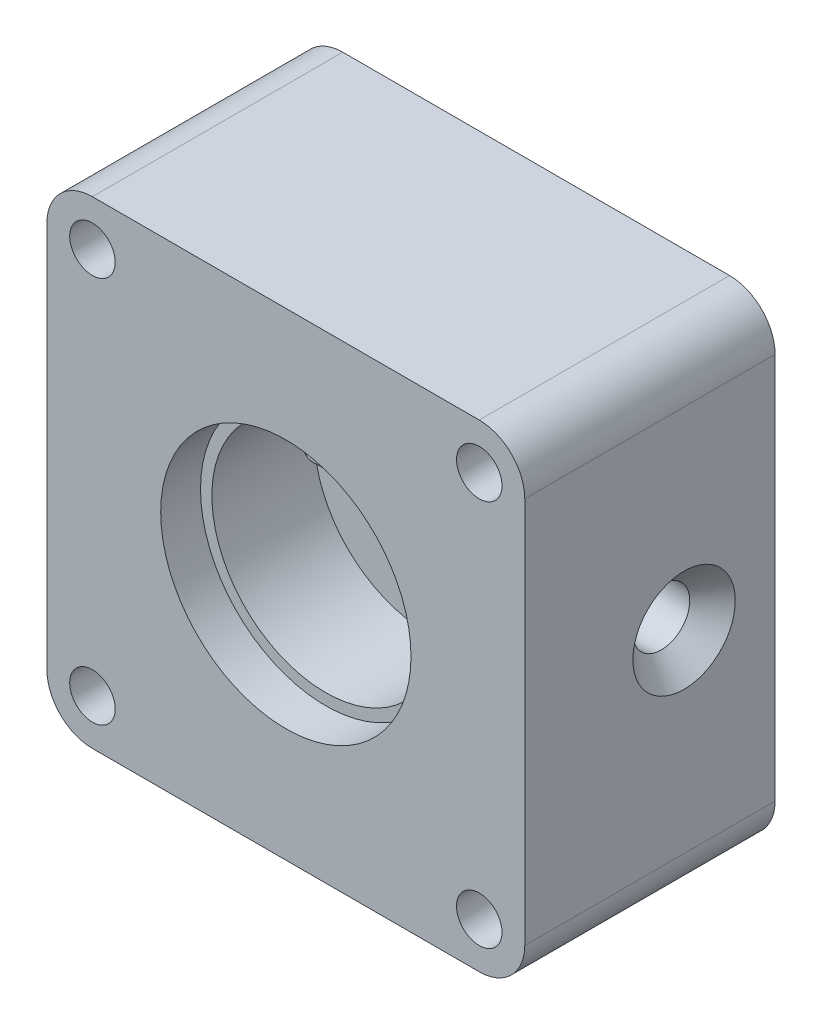
from build123d import *

# Parameters (mm, degrees)
CROQUIS1_W              = 42
CROQUIS1_H              = 42
SALIENTE_EXTRUIR1_DEPTH = 22
CROQUIS2_W              = 25
CROQUIS2_H              = 25
CROQUIS2_W_2            = 22.6
CROQUIS2_H_2            = 22.6
CORTAR_EXTRUIR1_DEPTH   = 15
CROQUIS3_R              = 5
CORTAR_EXTRUIR2_DEPTH   = 37.959437225
CROQUIS4_R              = 11
CORTAR_EXTRUIR3_DEPTH   = 3.5
CROQUIS5_R              = 10
CORTAR_EXTRUIR4_DEPTH   = 9
CROQUIS6_R              = 2
CORTAR_EXTRUIR5_DEPTH   = 37.959437225
REDONDEO1_R             = 4
CROQUIS7_R              = 2.5
CORTAR_EXTRUIR7_DEPTH   = 52.85556865
CHAFL_N1_SIZE           = 2


with BuildPart() as part:
    # Croquis1 → Saliente-Extruir1 (new body)
    with BuildSketch(Plane.XY):
        Rectangle(CROQUIS1_W, CROQUIS1_H)
    extrude(amount=SALIENTE_EXTRUIR1_DEPTH)

    # Croquis2 → Cortar-Extruir1 (cut)
    with BuildSketch(Plane(origin=(0, 0, 0), x_dir=(-1, 0, 0), z_dir=(0, 0, -1))):
        Rectangle(CROQUIS2_W, CROQUIS2_H)
        Rectangle(CROQUIS2_W_2, CROQUIS2_H_2, mode=Mode.SUBTRACT)
    extrude(amount=-CORTAR_EXTRUIR1_DEPTH, mode=Mode.SUBTRACT)

    # Croquis3 → Cortar-Extruir2 (cut, through all)
    with BuildSketch(Plane.XY.offset(22)):
        Circle(CROQUIS3_R)
    extrude(amount=-CORTAR_EXTRUIR2_DEPTH, mode=Mode.SUBTRACT)

    # Croquis4 → Cortar-Extruir3 (cut)
    with BuildSketch(Plane.XY.offset(22)):
        Circle(CROQUIS4_R)
    extrude(amount=-CORTAR_EXTRUIR3_DEPTH, mode=Mode.SUBTRACT)

    # Croquis5 → Cortar-Extruir4 (cut)
    with BuildSketch(Plane.XY.offset(18.5)):
        Circle(CROQUIS5_R)
    extrude(amount=-CORTAR_EXTRUIR4_DEPTH, mode=Mode.SUBTRACT)

    # Croquis6 → Cortar-Extruir5 (cut, through all)
    with BuildSketch(Plane(origin=(0, 0, 0), x_dir=(-1, 0, 0), z_dir=(0, 0, -1))):
        with Locations((17, 17)):
            Circle(CROQUIS6_R)
        with Locations((-17, 17)):
            Circle(CROQUIS6_R)
        with Locations((-17, -17)):
            Circle(CROQUIS6_R)
        with Locations((17, -17)):
            Circle(CROQUIS6_R)
    extrude(amount=-CORTAR_EXTRUIR5_DEPTH, mode=Mode.SUBTRACT)

    # Redondeo1
    redondeo1_edges = [part.edges().sort_by_distance(p)[0] for p in [
        (21, -21, 11),
        (-21, -21, 11),
        (-21, 21, 11),
        (21, 21, 11),
    ]]
    fillet(redondeo1_edges, radius=REDONDEO1_R)

    # Croquis7 → Cortar-Extruir7 (cut, through all)
    with BuildSketch(Plane(origin=(21, 0, 0), x_dir=(0, 0, -1), z_dir=(1, 0, 0))):
        with Locations(Location((-8, 0, 0), (0, 0, 126.869897646))):
            Circle(CROQUIS7_R)
    extrude(amount=-CORTAR_EXTRUIR7_DEPTH, mode=Mode.SUBTRACT)

    # Chaflán1
    chafl_n1_edges = [part.edges().sort_by_distance(p)[0] for p in [
        (-21, -2, 6.5),
        (21, -2, 6.5),
    ]]
    chamfer(chafl_n1_edges, length=CHAFL_N1_SIZE)


solid = part.part
